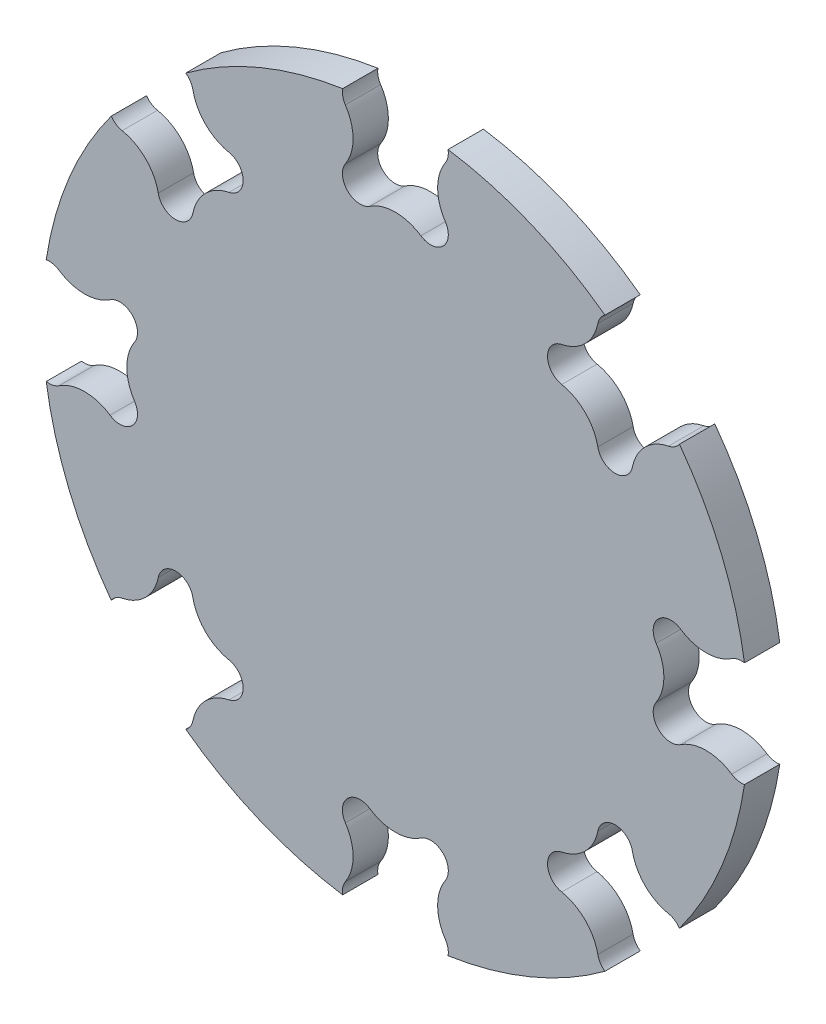
from build123d import *

# Parameters (mm, degrees)
SKETCH_1_R               = 100
EXTRUDE_1_DEPTH          = 10
CUT_EXTRUDE_5_DEPTH      = 142.774468788
PATTERN_CIRCULAR_1_COUNT = 8


with BuildPart() as part:
    # 草圖1 → 伸長1 (new body)
    with BuildSketch(Plane.XY):
        Circle(SKETCH_1_R)
    extrude(amount=EXTRUDE_1_DEPTH)

    # 草圖2 → 伸長5 (cut, through all)
    with BuildSketch(Plane.XY):
        with BuildLine():
            ThreePointArc((14.160251472, 95.254255396), (11.972243623, 88.027756377), (14.160251472, 80.801257358))
            ThreePointArc((14.160251472, 80.801257358), (13.535533906, 74.492222471), (7.226499019, 73.867504906))
            ThreePointArc((7.226499019, 73.867504906), (0, 76.055512755), (-7.226499019, 73.867504906))
            ThreePointArc((-7.226499019, 73.867504906), (-13.535533906, 74.492222471), (-14.160251472, 80.801257358))
            ThreePointArc((-14.160251472, 80.801257358), (-11.972243623, 88.027756377), (-14.160251472, 95.254255396))
            ThreePointArc((-14.160251472, 95.254255396), (-13.535533906, 101.563290283), (-7.226499019, 102.188007849))
            ThreePointArc((-7.226499019, 102.188007849), (0, 100), (7.226499019, 102.188007849))
            ThreePointArc((7.226499019, 102.188007849), (13.535533906, 101.563290283), (14.160251472, 95.254255396))
        make_face()
    cut_extrude_5 = extrude(amount=CUT_EXTRUDE_5_DEPTH, mode=Mode.SUBTRACT)

    # 環狀複製排列1: 伸長5 ×8 about axis
    pattern_circular_1_axis = Axis((0, 0, 0), (0, 0, 1))
    for i in range(1, PATTERN_CIRCULAR_1_COUNT):
        add(cut_extrude_5.rotate(pattern_circular_1_axis, i * 360 / PATTERN_CIRCULAR_1_COUNT), mode=Mode.SUBTRACT)


solid = part.part
